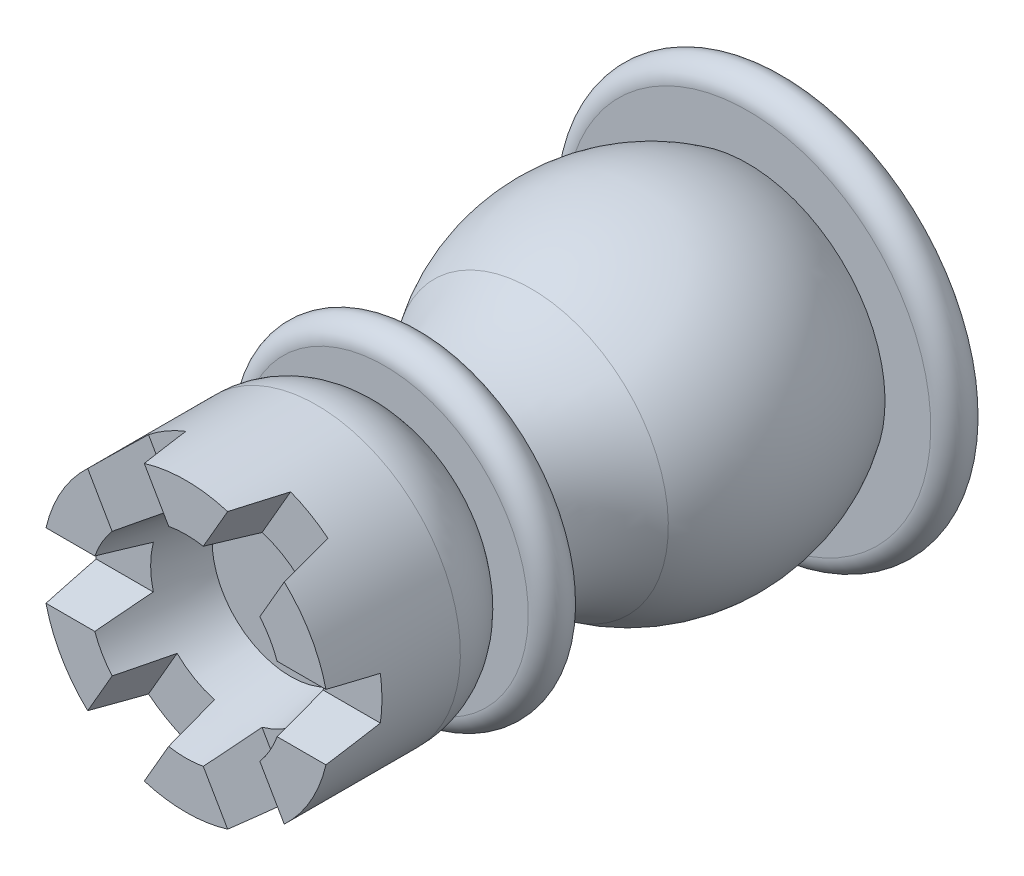
from build123d import *

# Parameters (mm, degrees)
CUT_EXTRUDE1_DEPTH = 51.955863315
CIRPATTERN1_COUNT  = 6


with BuildPart() as part:
    # Sketch1 → Revolve1 (revolve)
    with BuildSketch(Plane.YZ, mode=Mode.PRIVATE) as revolve1_sk:
        with BuildLine():
            Line((0, 0), (14, 0))
            ThreePointArc((14, 0), (15.5, 1.5), (14, 3))
            Line((14, 3), (10.5, 3))
            ThreePointArc((10.5, 3), (13, 11.29163817), (10.499915764, 19.583250941))
            ThreePointArc((10.499915764, 19.583250941), (8.648748728, 23.510719191), (8, 27.803847577))
            Line((8, 27.803847577), (11, 27.803847577))
            ThreePointArc((11, 27.803847577), (12.5, 29.303847577), (11, 30.803847577))
            Line((11, 30.803847577), (8, 30.803847577))
            ThreePointArc((8, 30.803847577), (10.196152423, 33), (11, 36))
            Line((11, 36), (11, 46))
            Line((11, 46), (7.410615846, 46))
            Line((7.410615846, 46), (6, 38))
            Line((6, 38), (0, 38))
            Line((0, 38), (0, 0))
        make_face()
    revolve(revolve1_sk.sketch.rotate(Axis((0, 0, 46), (0, 0, -1)), 180), axis=Axis((0, 0, 46), (0, 0, -1)))

    # Sketch2 → Cut-Extrude1 (cut, symmetric)
    with BuildSketch(Plane.YZ):
        Polygon((-1.649773753, 42), (1.649773753, 42), (2.5, 46), (-2.5, 46), align=None)
    cut_extrude1 = extrude(amount=CUT_EXTRUDE1_DEPTH, both=True, mode=Mode.SUBTRACT)

    # CirPattern1: Cut-Extrude1 ×6 about axis
    cirpattern1_axis = Axis((0, 0, 0), (0, 0, 1))
    for i in range(1, CIRPATTERN1_COUNT):
        add(cut_extrude1.rotate(cirpattern1_axis, i * 360 / CIRPATTERN1_COUNT), mode=Mode.SUBTRACT)


solid = part.part
